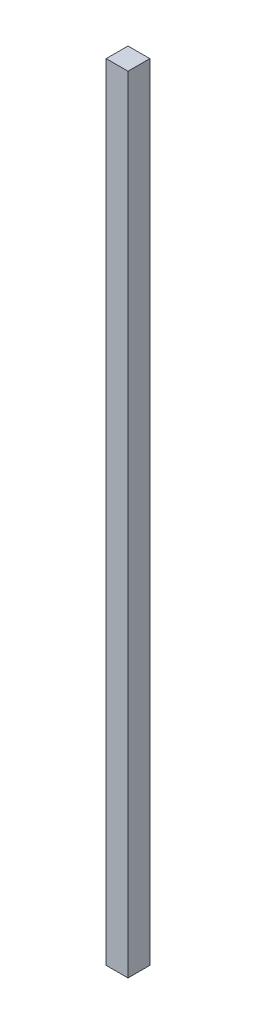
from build123d import *

# Parameters (mm, degrees)
SKETCH1_W           = 50.8
SKETCH1_H           = 50.8
BOSS_EXTRUDE1_DEPTH = 1828.8


with BuildPart() as part:
    # Sketch1 → Boss-Extrude1 (new body)
    with BuildSketch(Plane(origin=(0, 0, 0), x_dir=(1, 0, 0), z_dir=(0, 1, 0))):
        Rectangle(SKETCH1_W, SKETCH1_H)
    extrude(amount=BOSS_EXTRUDE1_DEPTH)


solid = part.part
